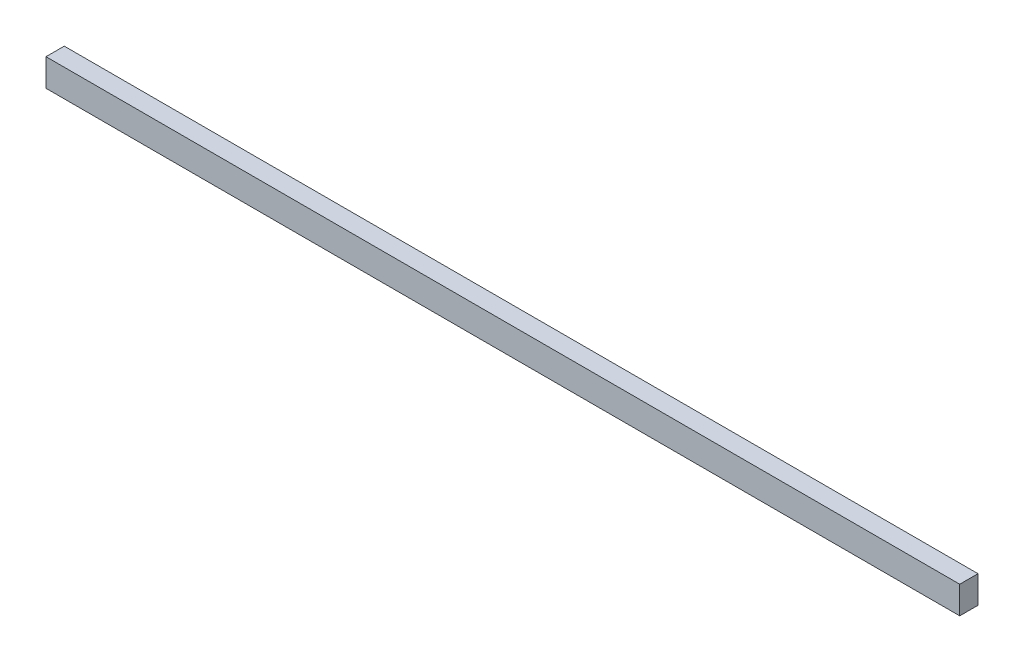
from build123d import *

# Parameters (mm, degrees)
SKETCH_2_W      = 0.02
SKETCH_2_H      = 0.03
EXTRUDE_2_DEPTH = 1


with BuildPart() as part:
    # 草图2 → 凸台-拉伸2 (new body)
    with BuildSketch(Plane(origin=(0, 0, 0), x_dir=(0, 0, -1), z_dir=(1, 0, 0))):
        Rectangle(SKETCH_2_W, SKETCH_2_H)
    extrude(amount=EXTRUDE_2_DEPTH)


solid = part.part
